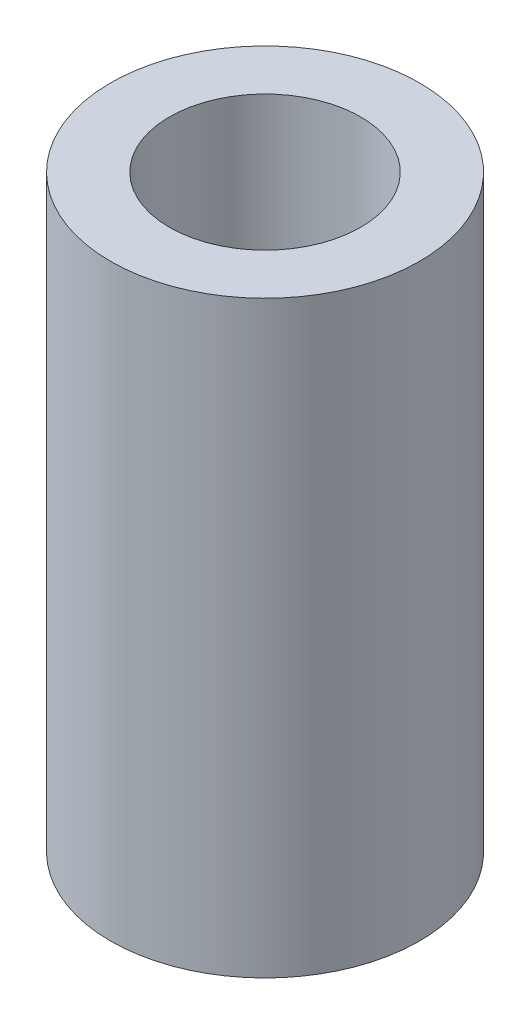
from build123d import *

# Parameters (mm, degrees)
SKETCH_1_R      = 5.25
SKETCH_1_R_2    = 3.25
EXTRUDE_1_DEPTH = 20


with BuildPart() as part:
    # 草图1 → 凸台-拉伸1 (new body)
    with BuildSketch(Plane(origin=(0, 0, 0), x_dir=(1, 0, 0), z_dir=(0, 1, 0))):
        with Locations(Location((0, -0.104032488, 0), (0, 0, 270))):
            Circle(SKETCH_1_R)
        with Locations(Location((0, -0.104032488, 0), (0, 0, 270))):
            Circle(SKETCH_1_R_2, mode=Mode.SUBTRACT)
    extrude(amount=EXTRUDE_1_DEPTH)


solid = part.part
